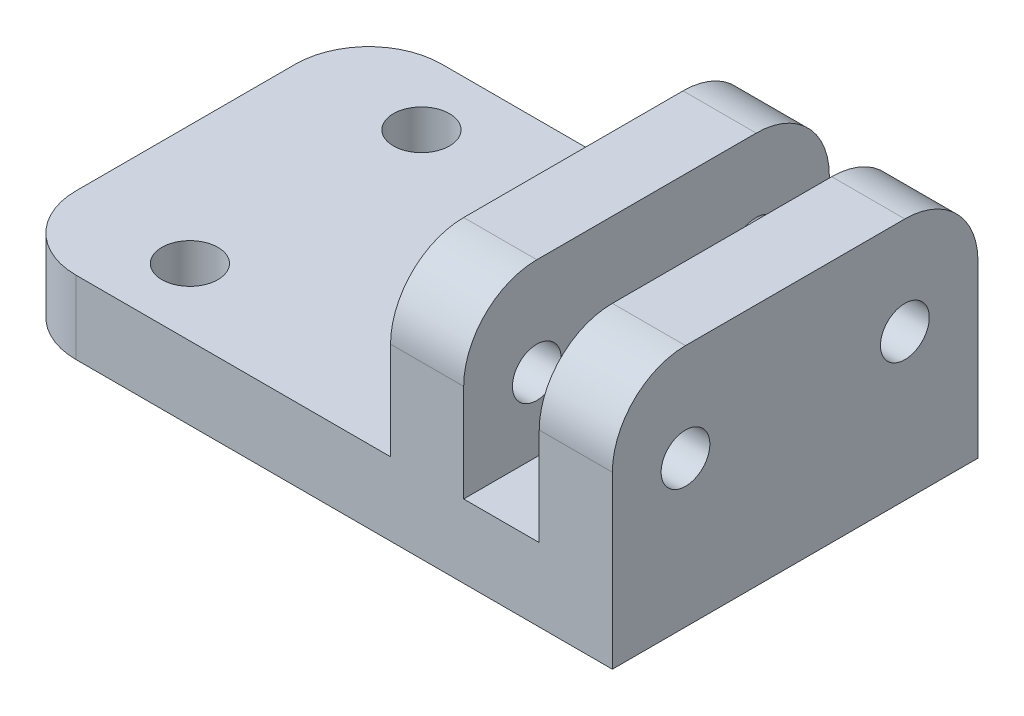
from build123d import *

# Parameters (mm, degrees)
SKETCH1_W               = 25
SKETCH1_H               = 15
SKETCH1_R               = 1.15
BOSS_EXTRUDE1_DEPTH     = 3
FILLET1_R               = 3
SKETCH1_3_W             = 3
SKETCH1_3_H             = 15
BOSS_EXTRUDE2_DEPTH     = 10
CUT_EXTRUDE1_DEPTH      = 25.037678756
CUT_EXTRUDE1_DEPTH_BACK = 25.037678756
SKETCH2_R               = 1
FILLET2_R               = 3


with BuildPart() as part:
    # Sketch1 → Boss-Extrude1 (new body)
    with BuildSketch(Plane(origin=(0, 0, 0), x_dir=(1, 0, 0), z_dir=(0, 1, 0))):
        with Locations((12.5, 7.5)):
            Rectangle(SKETCH1_W, SKETCH1_H)
        with Locations((4.917465758, 2.75)):
            Circle(SKETCH1_R, mode=Mode.SUBTRACT)
        with Locations((4.917465758, 12.25)):
            Circle(SKETCH1_R, mode=Mode.SUBTRACT)
    extrude(amount=BOSS_EXTRUDE1_DEPTH)

    # Fillet1
    fillet1_edges = [part.edges().sort_by_distance(p)[0] for p in [
        (0, 1.5, -15),
        (25, 1.5, -15),
        (25, 1.5, 0),
        (0, 1.5, 0),
    ]]
    fillet(fillet1_edges, radius=FILLET1_R)

    # Sketch1<3> → Boss-Extrude2 (add)
    with BuildSketch(Plane(origin=(0, 0, 0), x_dir=(1, 0, 0), z_dir=(0, 1, 0))):
        with Locations((17.4, 7.5)):
            Rectangle(SKETCH1_3_W, SKETCH1_3_H)
        with Locations((23.5, 7.5)):
            Rectangle(SKETCH1_3_W, SKETCH1_3_H)
    extrude(amount=BOSS_EXTRUDE2_DEPTH)

    # Sketch2 → Cut-Extrude1 (cut, two sides: drawn at the far end of the back side and taken through both)
    with BuildSketch(Plane.ZY.offset(-15.9).offset(-CUT_EXTRUDE1_DEPTH_BACK)):
        with Locations((-12, 6)):
            Circle(SKETCH2_R)
        with Locations((-3, 6)):
            Circle(SKETCH2_R)
    extrude(amount=CUT_EXTRUDE1_DEPTH + CUT_EXTRUDE1_DEPTH_BACK, mode=Mode.SUBTRACT)

    # Fillet2
    fillet2_edges = [part.edges().sort_by_distance(p)[0] for p in [
        (23.5, 10, 0),
        (17.4, 10, 0),
        (23.5, 10, -15),
        (17.4, 10, -15),
    ]]
    fillet(fillet2_edges, radius=FILLET2_R)


solid = part.part
